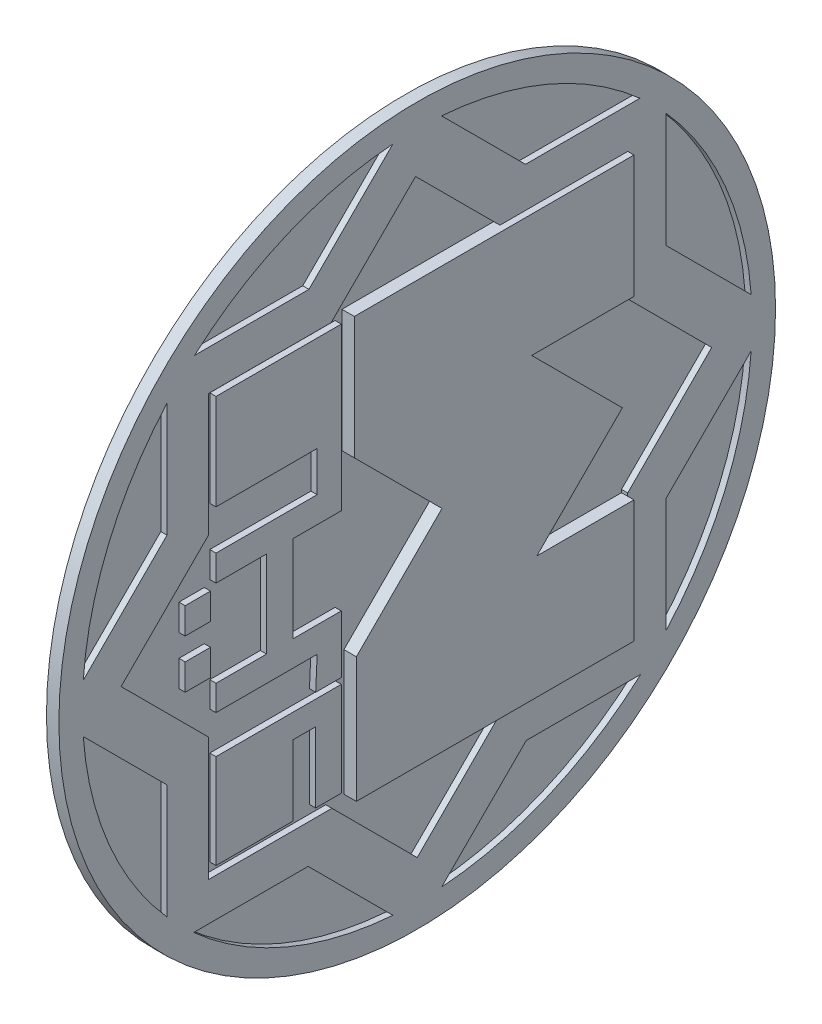
from build123d import *

# Parameters (mm, degrees)
SKETCH11_R            = 288.5
BOSS_EXTRUDE7_DEPTH   = 10
BOSS_EXTRUDE7_2_DEPTH = 10
BOSS_EXTRUDE7_3_DEPTH = 10
SKETCH11_W            = 21.16178464
SKETCH11_H            = 20.378014839
BOSS_EXTRUDE7_4_DEPTH = 10
BOSS_EXTRUDE7_5_DEPTH = 10
SKETCH11_7_W          = 21.16178464
SKETCH11_7_H          = 20.378014839
BOSS_EXTRUDE8_DEPTH   = 5
BOSS_EXTRUDE9_DEPTH   = 15


with BuildPart() as part:
    # Sketch11 → Boss-Extrude7 (new body)
    with BuildSketch(Plane.YZ):
        with Locations((288.5, 288.5)):
            Circle(SKETCH11_R)
        with BuildLine():
            ThreePointArc((109.345306024, 489.925647915), (183.537908139, 536.797513648), (268.854516394, 557.354516394))
            Line((268.854516394, 557.354516394), (201.425647915, 489.925647915))
            Line((201.425647915, 489.925647915), (109.345306024, 489.925647915))
        make_face(mode=Mode.SUBTRACT)
        with BuildLine():
            ThreePointArc((19.645483606, 308.145483606), (40.419345952, 393.973622763), (87.814555723, 468.483467205))
            Line((87.814555723, 468.483467205), (87.814555723, 376.314555723))
            Line((87.814555723, 376.314555723), (19.645483606, 308.145483606))
        make_face(mode=Mode.SUBTRACT)
        with BuildLine():
            ThreePointArc((87.814555723, 108.516532795), (40.419345952, 183.026377237), (19.645483606, 268.854516394))
            Line((19.645483606, 268.854516394), (87.814555723, 200.685444277))
            Line((87.814555723, 200.685444277), (87.814555723, 108.516532795))
        make_face(mode=Mode.SUBTRACT)
        with BuildLine():
            ThreePointArc((268.854516394, 19.645483606), (182.717255503, 40.550999239), (108.016830289, 88.263835777))
            Line((108.016830289, 88.263835777), (200.236164223, 88.263835777))
            Line((200.236164223, 88.263835777), (268.854516394, 19.645483606))
        make_face(mode=Mode.SUBTRACT)
        with BuildLine():
            ThreePointArc((468.983169711, 88.263835777), (394.282744497, 40.550999239), (308.145483606, 19.645483606))
            Line((308.145483606, 19.645483606), (376.763835777, 88.263835777))
            Line((376.763835777, 88.263835777), (468.983169711, 88.263835777))
        make_face(mode=Mode.SUBTRACT)
        with BuildLine():
            ThreePointArc((557.354516394, 268.854516394), (536.771151329, 183.475567464), (489.835656115, 109.244178369))
            Line((489.835656115, 109.244178369), (489.835656115, 201.335656115))
            Line((489.835656115, 201.335656115), (557.354516394, 268.854516394))
        make_face(mode=Mode.SUBTRACT)
        with BuildLine():
            ThreePointArc((489.835656115, 467.755821631), (536.771151329, 393.524432536), (557.354516394, 308.145483606))
            Line((557.354516394, 308.145483606), (489.835656115, 375.664343885))
            Line((489.835656115, 375.664343885), (489.835656115, 467.755821631))
        make_face(mode=Mode.SUBTRACT)
        with BuildLine():
            ThreePointArc((308.145483606, 557.354516394), (393.462091861, 536.797513648), (467.654693976, 489.925647915))
            Line((467.654693976, 489.925647915), (375.574352085, 489.925647915))
            Line((375.574352085, 489.925647915), (308.145483606, 557.354516394))
        make_face(mode=Mode.SUBTRACT)
        Polygon((457.657670049, 119.01635474), (354.785355806, 119.01635474), (287.171816153, 51.402815088), (219.558276501, 119.01635474), (118.728003632, 119.01635474), (118.728003632, 219.846627609), (50.074631241, 288.5), (118.728003632, 357.153372391), (118.728003632, 456.354802066), (217.929433307, 456.354802066), (288.5, 526.925368759), (359.070566693, 456.354802066), (457.657670049, 456.354802066), (457.657670049, 357.76769871), (525.597184912, 289.828183847), (457.657670049, 221.888668984), align=None, mode=Mode.SUBTRACT)
    extrude(amount=BOSS_EXTRUDE7_DEPTH)



with BuildPart() as body_2:
    # Sketch11 → Boss-Extrude7 2 (new body)
    with BuildSketch(Plane.YZ):
        Polygon((201.425647915, 450.488919168), (125.489898595, 450.488919168), (125.489898595, 388.458487724), (182.175584131, 388.458487724), (182.175584131, 370.245546136), (125.489898595, 370.245546136), (125.489898595, 349.632569577), (201.425647915, 349.632569577), align=None)
    extrude(amount=BOSS_EXTRUDE7_2_DEPTH)


with BuildPart() as body_3:
    # Sketch11 → Boss-Extrude7 3 (new body)
    with BuildSketch(Plane.YZ):
        Polygon((232.103371973, 369.045528651), (206.163784466, 370.245546136), (206.163784466, 349.632569577), (252.593459139, 349.632569577), (252.593459139, 388.458487724), (322.412082429, 388.458487724), (322.412082429, 349.632569577), (452.588861428, 349.632569577), (452.588861428, 450.488919168), (375.574352085, 450.488919168), (375.574352085, 369.045528651), (343.349626731, 369.045528651), (343.349626731, 450.488919168), (322.412082429, 450.488919168), (322.412082429, 409.767223909), (252.593459139, 409.767223909), (252.593459139, 450.488919168), (232.103371973, 450.488919168), align=None)
    extrude(amount=BOSS_EXTRUDE7_3_DEPTH)


with BuildPart() as body_4:
    # Sketch11 → Boss-Extrude7 4 (new body)
    with BuildSketch(Plane.YZ):
        with Locations((269.315694793, 465.124823328)):
            Rectangle(SKETCH11_W, SKETCH11_H)
    extrude(amount=BOSS_EXTRUDE7_4_DEPTH)


with BuildPart() as body_5:
    # Sketch11 → Boss-Extrude7 5 (new body)
    with BuildSketch(Plane.YZ):
        with Locations((308.504184867, 465.124823328)):
            Rectangle(SKETCH11_W, SKETCH11_H)
    extrude(amount=BOSS_EXTRUDE7_5_DEPTH)


with BuildPart() as part_1:
    add(part.part)

    add(body_2.part)  # Boss-Extrude8 merges body 2

    add(body_3.part)  # Boss-Extrude8 merges body 3

    add(body_4.part)  # Boss-Extrude8 merges body 4

    add(body_5.part)  # Boss-Extrude8 merges body 5
    # Sketch11<7> → Boss-Extrude8 (add)
    # profile 1 of 10: a face of its own
    with BuildSketch(Plane.YZ):
        with BuildLine():
            Line((201.425647915, 489.925647915), (268.854516394, 557.354516394))
            ThreePointArc((268.854516394, 557.354516394), (183.537908139, 536.797513648), (109.345306024, 489.925647915))
            Line((109.345306024, 489.925647915), (201.425647915, 489.925647915))
        make_face()
    # profile 2 of 10: a face of its own
    with BuildSketch(Plane.YZ):
        with BuildLine():
            ThreePointArc((467.654693976, 489.925647915), (393.462091861, 536.797513648), (308.145483606, 557.354516394))
            Line((308.145483606, 557.354516394), (375.574352085, 489.925647915))
            Line((375.574352085, 489.925647915), (467.654693976, 489.925647915))
        make_face()
    # profile 3 of 10: a face of its own
    with BuildSketch(Plane.YZ):
        with BuildLine():
            Line((87.814555723, 376.314555723), (87.814555723, 468.483467205))
            ThreePointArc((87.814555723, 468.483467205), (40.419345952, 393.973622763), (19.645483606, 308.145483606))
            Line((19.645483606, 308.145483606), (87.814555723, 376.314555723))
        make_face()
    # profile 4 of 10: a face of its own
    with BuildSketch(Plane.YZ):
        with BuildLine():
            ThreePointArc((557.354516394, 308.145483606), (536.771151329, 393.524432536), (489.835656115, 467.755821631))
            Line((489.835656115, 467.755821631), (489.835656115, 375.664343885))
            Line((489.835656115, 375.664343885), (557.354516394, 308.145483606))
        make_face()
    # profile 5 of 10: a face of its own
    with BuildSketch(Plane.YZ):
        with BuildLine():
            Line((87.814555723, 200.685444277), (19.645483606, 268.854516394))
            ThreePointArc((19.645483606, 268.854516394), (40.419345952, 183.026377237), (87.814555723, 108.516532795))
            Line((87.814555723, 108.516532795), (87.814555723, 200.685444277))
        make_face()
    # profile 6 of 10: a face of its own
    with BuildSketch(Plane.YZ):
        with BuildLine():
            ThreePointArc((489.835656115, 109.244178369), (536.771151329, 183.475567464), (557.354516394, 268.854516394))
            Line((557.354516394, 268.854516394), (489.835656115, 201.335656115))
            Line((489.835656115, 201.335656115), (489.835656115, 109.244178369))
        make_face()
    # profile 7 of 10: a face of its own
    with BuildSketch(Plane.YZ):
        with BuildLine():
            Line((200.236164223, 88.263835777), (108.016830289, 88.263835777))
            ThreePointArc((108.016830289, 88.263835777), (182.717255503, 40.550999239), (268.854516394, 19.645483606))
            Line((268.854516394, 19.645483606), (200.236164223, 88.263835777))
        make_face()
    # profile 8 of 10: a face of its own
    with BuildSketch(Plane.YZ):
        with BuildLine():
            ThreePointArc((308.145483606, 19.645483606), (394.282744497, 40.550999239), (468.983169711, 88.263835777))
            Line((468.983169711, 88.263835777), (376.763835777, 88.263835777))
            Line((376.763835777, 88.263835777), (308.145483606, 19.645483606))
        make_face()
    # profile 9 of 10: a face of its own
    with BuildSketch(Plane.YZ):
        Polygon((217.929433307, 456.354802066), (118.728003632, 456.354802066), (118.728003632, 357.153372391), (50.074631241, 288.5), (118.728003632, 219.846627609), (118.728003632, 342.490695719), (219.558276501, 342.490695719), (288.5, 273.54897222), (359.070566693, 344.119538913), (457.657670049, 344.119538913), (457.657670049, 221.888668984), (525.597184912, 289.828183847), (457.657670049, 357.76769871), (457.657670049, 456.354802066), (359.070566693, 456.354802066), (288.5, 526.925368759), align=None)
        Polygon((125.489898595, 388.458487724), (125.489898595, 450.488919168), (201.425647915, 450.488919168), (201.425647915, 349.632569577), (125.489898595, 349.632569577), (125.489898595, 370.245546136), (182.175584131, 370.245546136), (182.175584131, 388.458487724), align=None, mode=Mode.SUBTRACT)
        with Locations((269.315694793, 465.124823328)):
            Rectangle(SKETCH11_7_W, SKETCH11_7_H, mode=Mode.SUBTRACT)
        Polygon((206.163784466, 349.632569577), (206.163784466, 370.245546136), (232.103371973, 369.045528651), (232.103371973, 450.488919168), (252.593459139, 450.488919168), (252.593459139, 409.767223909), (322.412082429, 409.767223909), (322.412082429, 450.488919168), (343.349626731, 450.488919168), (343.349626731, 369.045528651), (375.574352085, 369.045528651), (375.574352085, 450.488919168), (452.588861428, 450.488919168), (452.588861428, 349.632569577), (322.412082429, 349.632569577), (322.412082429, 388.458487724), (252.593459139, 388.458487724), (252.593459139, 349.632569577), align=None, mode=Mode.SUBTRACT)
        with Locations((308.504184867, 465.124823328)):
            Rectangle(SKETCH11_7_W, SKETCH11_7_H, mode=Mode.SUBTRACT)
    # profile 10 of 10: a face of its own
    with BuildSketch(Plane.YZ):
        Polygon((217.219769177, 197.201333657), (217.219769177, 119.01635474), (219.558276501, 119.01635474), (287.171816153, 51.402815088), (354.785355806, 119.01635474), (359.070566693, 119.01635474), (359.070566693, 201.335656115), (286.078006706, 128.343096128), align=None)
    extrude(amount=BOSS_EXTRUDE8_DEPTH)

    # Sketch11<8> → Boss-Extrude9 (add)
    with BuildSketch(Plane.YZ):
        Polygon((118.728003632, 342.490695719), (118.728003632, 219.846627609), (118.728003632, 119.01635474), (217.219769177, 119.01635474), (217.219769177, 197.201333657), (286.078006706, 128.343096128), (359.070566693, 201.335656115), (359.070566693, 119.01635474), (457.657670049, 119.01635474), (457.657670049, 221.888668984), (457.657670049, 344.119538913), (359.070566693, 344.119538913), (288.5, 273.54897222), (219.558276501, 342.490695719), align=None)
    extrude(amount=BOSS_EXTRUDE9_DEPTH)


solid = part_1.part
